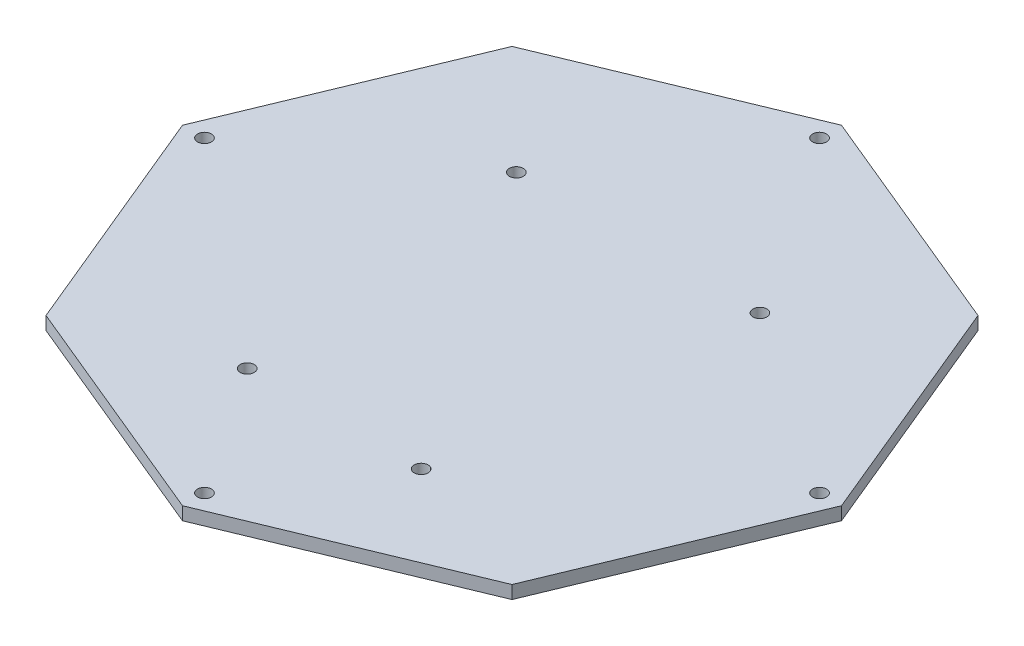
from build123d import *

# Parameters (mm, degrees)
BOSS_EXTRUDE2_DEPTH     = 3
CUT_EXTRUDE3_DEPTH      = 108.193349502
CUT_EXTRUDE3_DEPTH_BACK = 108.193349502
SKETCH3_R               = 1.6
CUT_EXTRUDE4_DEPTH      = 108.193349502
CUT_EXTRUDE4_DEPTH_BACK = 108.193349502
SKETCH4_R               = 1.6


with BuildPart() as part:
    # Sketch1 → Boss-Extrude2 (new body)
    with BuildSketch(Plane(origin=(0, 0, 0), x_dir=(1, 0, 0), z_dir=(0, 1, 0))):
        Polygon((0, -75.76745402), (53.575680531, -53.575680531), (75.76745402, 0), (53.575680531, 53.575680531), (0, 75.76745402), (-53.575680531, 53.575680531), (-75.76745402, 0), (-53.575680531, -53.575680531), align=None)
    extrude(amount=BOSS_EXTRUDE2_DEPTH)

    # Sketch3 → Cut-Extrude3 (cut, two sides: drawn at the far end of the back side and taken through both)
    with BuildSketch(Plane(origin=(0, 3, 0), x_dir=(1, 0, 0), z_dir=(0, 1, 0)).offset(-CUT_EXTRUDE3_DEPTH_BACK)):
        with Locations(Location((-70.710678119, 0, 0), (0, 0, 270))):
            Circle(SKETCH3_R)
        with Locations(Location((0, 70.710678119, 0), (0, 0, 270))):
            Circle(SKETCH3_R)
        with Locations(Location((70.710678119, 0, 0), (0, 0, 270))):
            Circle(SKETCH3_R)
        with Locations(Location((0, -70.710678119, 0), (0, 0, 270))):
            Circle(SKETCH3_R)
    extrude(amount=CUT_EXTRUDE3_DEPTH + CUT_EXTRUDE3_DEPTH_BACK, mode=Mode.SUBTRACT)

    # Sketch4 → Cut-Extrude4 (cut, two sides: drawn at the far end of the back side and taken through both)
    with BuildSketch(Plane(origin=(0, 3, 0), x_dir=(1, 0, 0), z_dir=(0, 1, 0)).offset(-CUT_EXTRUDE4_DEPTH_BACK)):
        with Locations(Location((-19.891628757, -41, 0), (0, 0, 270))):
            Circle(SKETCH4_R)
        with Locations(Location((20.108371243, -41, 0), (0, 0, 270))):
            Circle(SKETCH4_R)
        with Locations(Location((-28, 29, 0), (0, 0, 270))):
            Circle(SKETCH4_R)
        with Locations(Location((28, 29, 0), (0, 0, 270))):
            Circle(SKETCH4_R)
    extrude(amount=CUT_EXTRUDE4_DEPTH + CUT_EXTRUDE4_DEPTH_BACK, mode=Mode.SUBTRACT)


solid = part.part
